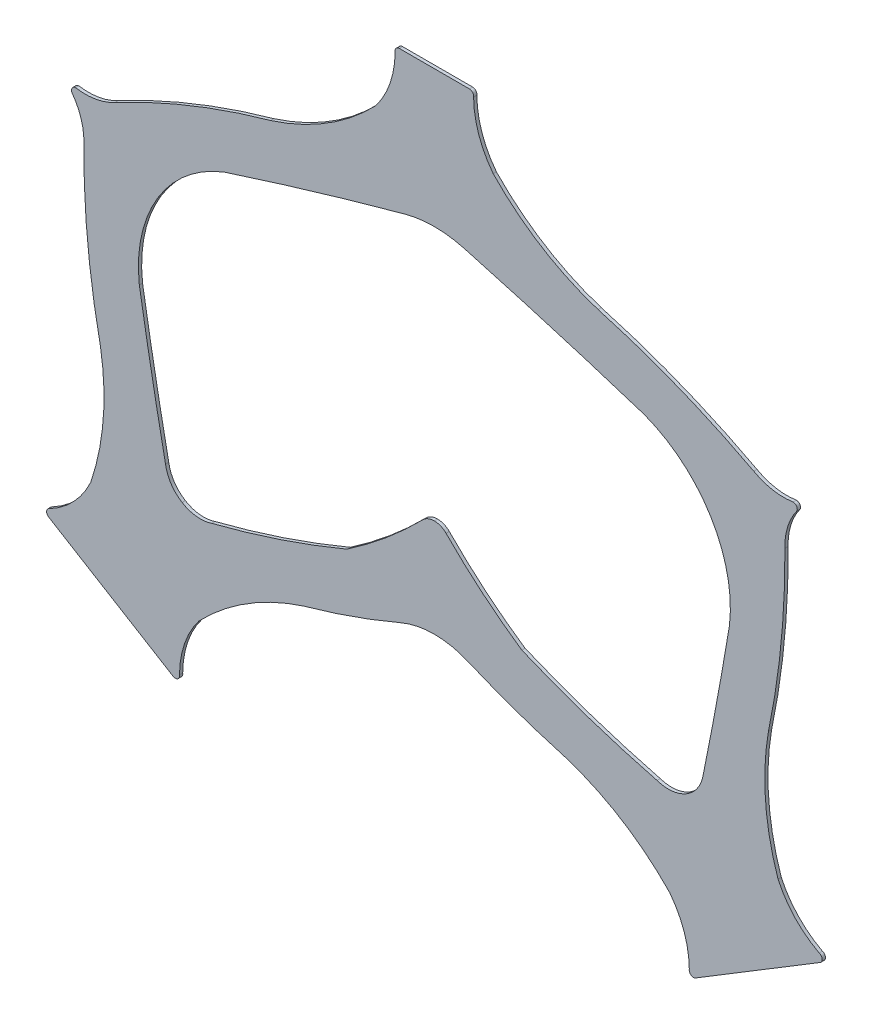
from build123d import *

# Parameters (mm, degrees)
BOSS_EXTRUDE1_DEPTH = 6.35


with BuildPart() as part:
    # Model → Boss-Extrude1 (new body)
    with BuildSketch(Plane.XY):
        with BuildLine():
            Line((31898.42286363, 25349.042544488), (32021.317821572, 25274.323174378))
            Line((32021.317821572, 25274.323174378), (32144.212779514, 25199.603804268))
            ThreePointArc((32144.212779514, 25199.603804268), (32153.335418666, 25199.871913635), (32156.80608396, 25208.312820585))
            ThreePointArc((32156.80608396, 25208.312820585), (32166.934550474, 25267.272799762), (32195.436643106, 25319.870287288))
            ThreePointArc((32195.436643106, 25319.870287288), (32211.326319487, 25335.678059434), (32227.916498791, 25350.749005866))
            ThreePointArc((32227.916498791, 25350.749005866), (32310.168795148, 25408.585953526), (32402.426345225, 25448.574667242))
            ThreePointArc((32402.426345225, 25448.574667242), (32499.230008667, 25479.077054216), (32593.818558867, 25515.878562856))
            ThreePointArc((32593.818558867, 25515.878562856), (32626.230367121, 25525.993933375), (32660.015563019, 25529.371295238))
            ThreePointArc((32660.015563019, 25529.371295238), (32693.800758918, 25525.993933375), (32726.212567172, 25515.878562856))
            ThreePointArc((32726.212567172, 25515.878562856), (32820.801117373, 25479.077054216), (32917.604780817, 25448.574667241))
            ThreePointArc((32917.604780817, 25448.574667241), (33009.862330892, 25408.585953526), (33092.114627248, 25350.749005866))
            ThreePointArc((33092.114627248, 25350.749005866), (33108.704806552, 25335.678059434), (33124.594482933, 25319.870287288))
            ThreePointArc((33124.594482933, 25319.870287288), (33153.096575565, 25267.272799762), (33163.225042079, 25208.312820585))
            ThreePointArc((33163.225042079, 25208.312820585), (33166.695707373, 25199.871913635), (33175.818346525, 25199.603804268))
            Line((33175.818346525, 25199.603804268), (33298.713304467, 25274.323174378))
            Line((33298.713304467, 25274.323174378), (33421.608262409, 25349.042544488))
            ThreePointArc((33421.608262409, 25349.042544488), (33425.568656461, 25357.265056675), (33419.672049026, 25364.231005892))
            ThreePointArc((33419.672049026, 25364.231005892), (33371.988421328, 25400.357680634), (33338.409358194, 25449.868401671))
            ThreePointArc((33338.409358194, 25449.868401671), (33313.689479446, 25570.177684815), (33319.405834276, 25692.867208832))
            ThreePointArc((33319.405834276, 25692.867208832), (33344.523884523, 25856.663875176), (33351.928568545, 26022.209744977))
            ThreePointArc((33351.928568545, 26022.209744977), (33357.389765533, 26062.007077803), (33375.619076587, 26097.802951743))
            ThreePointArc((33375.619076587, 26097.802951743), (33376.344425729, 26101.762571322), (33375.140233121, 26105.603748061))
            ThreePointArc((33375.140233121, 26105.603748061), (33372.284211734, 26108.440623176), (33368.435022132, 26109.618951649))
            ThreePointArc((33368.435022132, 26109.618951649), (33328.265776157, 26109.908866112), (33290.420159808, 26123.375925766))
            ThreePointArc((33290.420159808, 26123.375925766), (33140.039956563, 26192.989565418), (32983.06065556, 26246.072174717))
            ThreePointArc((32983.06065556, 26246.072174717), (32890.803105481, 26286.060888433), (32808.550809123, 26343.897836094))
            ThreePointArc((32808.550809123, 26343.897836094), (32791.960629818, 26358.968782526), (32776.070953438, 26374.776554672))
            ThreePointArc((32776.070953438, 26374.776554672), (32747.568860806, 26427.374042198), (32737.440394292, 26486.334021375))
            ThreePointArc((32737.440394292, 26486.334021375), (32735.652774311, 26493.233188238), (32729.201847174, 26496.262978274))
            Line((32729.201847174, 26496.262978274), (32660.015563019, 26496.262978274))
            Line((32660.015563019, 26496.262978274), (32590.829278865, 26496.262978274))
            ThreePointArc((32590.829278865, 26496.262978274), (32584.378351728, 26493.233188238), (32582.590731747, 26486.334021375))
            ThreePointArc((32582.590731747, 26486.334021375), (32572.462265233, 26427.374042198), (32543.960172601, 26374.776554672))
            ThreePointArc((32543.960172601, 26374.776554672), (32528.070496221, 26358.968782526), (32511.480316916, 26343.897836094))
            ThreePointArc((32511.480316916, 26343.897836094), (32429.228020558, 26286.060888433), (32336.970470479, 26246.072174717))
            ThreePointArc((32336.970470479, 26246.072174717), (32179.991169477, 26192.989565418), (32029.610966233, 26123.375925767))
            ThreePointArc((32029.610966233, 26123.375925767), (31991.765349883, 26109.908866112), (31951.596103907, 26109.618951649))
            ThreePointArc((31951.596103907, 26109.618951649), (31947.746914305, 26108.440623176), (31944.890892918, 26105.603748061))
            ThreePointArc((31944.890892918, 26105.603748061), (31943.68670031, 26101.762571322), (31944.412049452, 26097.802951743))
            ThreePointArc((31944.412049452, 26097.802951743), (31962.641360506, 26062.007077803), (31968.102557494, 26022.209744977))
            ThreePointArc((31968.102557494, 26022.209744977), (31975.507241516, 25856.663875176), (32000.625291763, 25692.867208832))
            ThreePointArc((32000.625291763, 25692.867208832), (32006.341646593, 25570.177684815), (31981.621767845, 25449.868401671))
            ThreePointArc((31981.621767845, 25449.868401671), (31948.042704711, 25400.357680634), (31900.359077013, 25364.231005892))
            ThreePointArc((31900.359077013, 25364.231005892), (31894.462469578, 25357.265056675), (31898.42286363, 25349.042544488))
        make_face()
        with BuildLine():
            Line((32162.020964729, 25505.660038211), (32161.945371032, 25505.705998708))
            ThreePointArc((32161.945371032, 25505.705998708), (32140.18746019, 25526.578681225), (32129.300144187, 25554.695258362))
            ThreePointArc((32129.300144187, 25554.695258362), (32102.130853739, 25694.796891925), (32077.511511077, 25835.369030123))
            ThreePointArc((32077.511511077, 25835.369030123), (32081.823540268, 25922.098711206), (32114.155190805, 26002.692107648))
            ThreePointArc((32114.155190805, 26002.692107648), (32170.826716382, 26068.487011443), (32245.841260727, 26112.230003031))
            ThreePointArc((32245.841260727, 26112.230003031), (32422.790125237, 26167.38397641), (32600.991121341, 26218.347359521))
            ThreePointArc((32600.991121341, 26218.347359521), (32630.238884468, 26224.274724699), (32660.015563019, 26226.253289931))
            ThreePointArc((32660.015563019, 26226.253289931), (32689.79224157, 26224.274724699), (32719.040004698, 26218.347359521))
            ThreePointArc((32719.040004698, 26218.347359521), (32897.241000802, 26167.38397641), (33074.189865311, 26112.230003031))
            ThreePointArc((33074.189865311, 26112.230003031), (33149.204409657, 26068.487011442), (33205.875935233, 26002.692107648))
            ThreePointArc((33205.875935233, 26002.692107648), (33238.20758577, 25922.098711206), (33242.519614962, 25835.369030123))
            ThreePointArc((33242.519614962, 25835.369030123), (33217.9002723, 25694.796891925), (33190.730981851, 25554.695258361))
            ThreePointArc((33190.730981851, 25554.695258361), (33179.843665848, 25526.578681224), (33158.085755006, 25505.705998708))
            Line((33158.085755006, 25505.705998708), (33158.010161449, 25505.660038295))
            ThreePointArc((33158.010161449, 25505.660038295), (33143.316900969, 25498.923547887), (33127.465891366, 25495.758472671))
            ThreePointArc((33127.465891366, 25495.758472671), (33113.302324791, 25496.059847259), (33099.49326847, 25499.223296059))
            ThreePointArc((33099.49326847, 25499.223296059), (32964.404231752, 25538.977287333), (32832.597057568, 25588.538325434))
            ThreePointArc((32832.597057568, 25588.538325434), (32754.7391258, 25647.320716043), (32683.062613492, 25713.500052457))
            ThreePointArc((32683.062613492, 25713.500052457), (32672.508818509, 25720.62082965), (32660.01556302, 25723.071671069))
            ThreePointArc((32660.01556302, 25723.071671069), (32647.52230753, 25720.62082965), (32636.968512547, 25713.500052457))
            ThreePointArc((32636.968512547, 25713.500052457), (32565.292000239, 25647.320716044), (32487.434068472, 25588.538325436))
            ThreePointArc((32487.434068472, 25588.538325436), (32355.626894288, 25538.977287334), (32220.537857569, 25499.223296059))
            ThreePointArc((32220.537857569, 25499.223296059), (32206.728801248, 25496.05984726), (32192.565234673, 25495.758472672))
            ThreePointArc((32192.565234673, 25495.758472672), (32176.714225147, 25498.923547863), (32162.020964729, 25505.660038211))
        make_face(mode=Mode.SUBTRACT)
    extrude(amount=BOSS_EXTRUDE1_DEPTH)


solid = part.part
